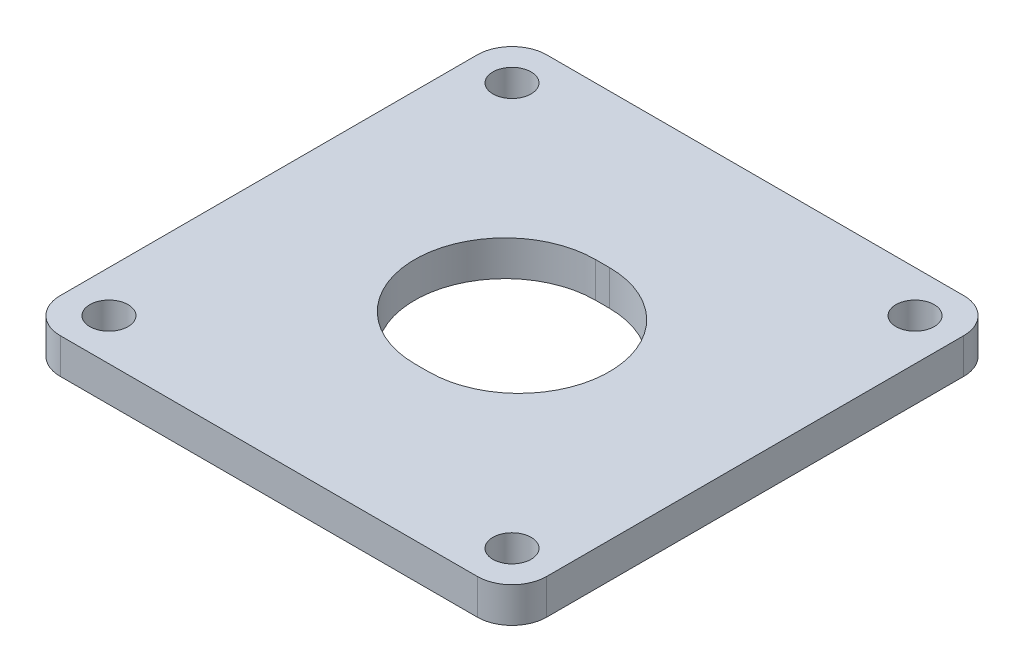
from build123d import *

# Parameters (mm, degrees)
SKETCH1_W           = 70
SKETCH1_H           = 70
SKETCH1_R           = 2.75
BOSS_EXTRUDE1_DEPTH = 5.08
FILLET1_R           = 5


with BuildPart() as part:
    # Sketch1 → Boss-Extrude1 (new body)
    with BuildSketch(Plane(origin=(0, 0, 0), x_dir=(1, 0, 0), z_dir=(0, 1, 0))):
        with Locations((35, 35)):
            Rectangle(SKETCH1_W, SKETCH1_H)
        with Locations(Location((6, 64, 0), (0, 0, 270))):
            Circle(SKETCH1_R, mode=Mode.SUBTRACT)
        with Locations(Location((64, 64, 0), (0, 0, 270))):
            Circle(SKETCH1_R, mode=Mode.SUBTRACT)
        with Locations(Location((64, 6, 0), (0, 0, 270))):
            Circle(SKETCH1_R, mode=Mode.SUBTRACT)
        with Locations(Location((6, 6, 0), (0, 0, 270))):
            Circle(SKETCH1_R, mode=Mode.SUBTRACT)
        with BuildLine():
            Line((34, 48), (36, 48))
            ThreePointArc((36, 48), (49, 35), (36, 22))
            Line((36, 22), (34, 22))
            ThreePointArc((34, 22), (21, 35), (34, 48))
        make_face(mode=Mode.SUBTRACT)
    extrude(amount=BOSS_EXTRUDE1_DEPTH)

    # Fillet1
    fillet1_edges = [part.edges().sort_by_distance(p)[0] for p in [
        (0, 2.54, -70),
        (70, 2.54, -70),
        (70, 2.54, 0),
        (0, 2.54, 0),
    ]]
    fillet(fillet1_edges, radius=FILLET1_R)


solid = part.part
